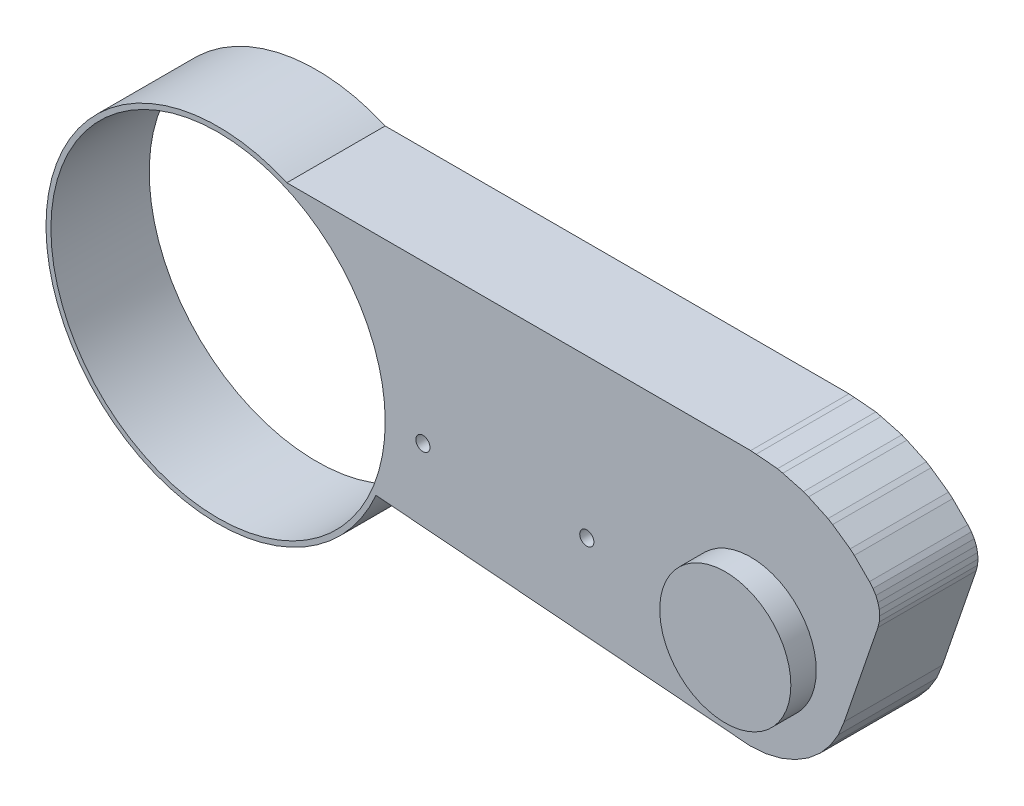
from build123d import *

# Parameters (mm, degrees)
BOSS_EXTRUDE1_START     = -3
SKETCH1_R               = 42
BOSS_EXTRUDE1_DEPTH     = 24
BOSS_EXTRUDE2_START     = -3
BOSS_EXTRUDE2_DEPTH     = 24
CUT_EXTRUDE1_START      = -3
CUT_EXTRUDE1_DEPTH      = 22.8
CUT_EXTRUDE2_DEPTH      = 169.170182404
CUT_EXTRUDE2_DEPTH_BACK = 169.170182404
SKETCH4_R               = 40.8
BOSS_EXTRUDE3_START     = 21
SKETCH5_R               = 16
BOSS_EXTRUDE3_DEPTH     = 6.2
CUT_EXTRUDE3_START      = 19.8
SKETCH6_R               = 14.8
CUT_EXTRUDE3_DEPTH      = 6.2
BOSS_EXTRUDE4_START     = 9
SKETCH7_R               = 3.5
BOSS_EXTRUDE4_DEPTH     = 10.8
CUT_EXTRUDE4_DEPTH      = 170.05635229
CUT_EXTRUDE4_DEPTH_BACK = 170.05635229
SKETCH8_R               = 1.725


with BuildPart() as part:
    # Sketch1 → Boss-Extrude1 (new body)
    with BuildSketch(Plane.XY.offset(BOSS_EXTRUDE1_START)):
        Circle(SKETCH1_R)
    extrude(amount=BOSS_EXTRUDE1_DEPTH)

    # Sketch2 → Boss-Extrude2 (add)
    with BuildSketch(Plane.XY.offset(BOSS_EXTRUDE2_START)):
        Polygon((-38.5, 0), (-38.3954, -1.3297), (-38.084, -2.6266), (-37.5736, -3.8589), (-36.8766, -4.9962), (-36.0104, -6.0104), (-34.9962, -6.8766), (-33.8589, -7.5736), (-32.6266, -8.084), (-31.3297, -8.3954), (27.497, -15.803), (126.2456, -23.7045), (130, -24), (133.7544, -23.7045), (137.4164, -22.8254), (140.8958, -21.3842), (144.1068, -19.4164), (146.9706, -16.9706), (149.4164, -14.1068), (151.3842, -10.8958), (152.8254, -7.4164), (161.0653, 16.657), (161.3767, 17.9539), (161.4813, 19.2836), (161.3767, 20.6133), (161.0653, 21.9103), (160.5549, 23.1425), (159.858, 24.2798), (158.9917, 25.294), (155.294, 28.9917), (154.2798, 29.858), (149.9962, 32.8574), (148.8589, 33.5543), (144.1195, 35.7643), (142.8872, 36.2748), (137.8361, 37.6282), (136.5391, 37.9396), (131.3297, 38.3954), (130, 38.5), (0, 38.5), (-1.3297, 38.3954), (-6.5391, 37.9396), (-7.8361, 37.6282), (-12.8872, 36.2748), (-14.1195, 35.7643), (-18.8589, 33.5543), (-19.9962, 32.8574), (-24.2798, 29.858), (-25.294, 28.9917), (-28.9917, 25.294), (-29.858, 24.2798), (-32.8574, 19.9962), (-33.5543, 18.8589), (-35.7643, 14.1195), (-36.2748, 12.8872), (-37.6282, 7.8361), (-37.9396, 6.5391), (-38.3954, 1.3297), align=None)
    extrude(amount=BOSS_EXTRUDE2_DEPTH)

    # Sketch3 → Cut-Extrude1 (cut)
    with BuildSketch(Plane.XY.offset(CUT_EXTRUDE1_START)):
        Polygon((-37.3, 0), (-37.2101, -1.142), (-36.9427, -2.2558), (-36.5043, -3.3141), (-35.9058, -4.2908), (-35.1619, -5.1619), (-34.2908, -5.9058), (-33.3141, -6.5043), (-32.2558, -6.9427), (-31.142, -7.2101), (27.6848, -14.6178), (126.4333, -22.5193), (130, -22.8), (133.5667, -22.5193), (137.0456, -21.6841), (140.351, -20.3149), (143.4015, -18.4456), (146.122, -16.122), (148.4456, -13.4015), (150.3149, -10.351), (151.6841, -7.0456), (159.924, 17.0278), (160.1915, 18.1417), (160.2813, 19.2836), (160.1915, 20.4256), (159.924, 21.5395), (159.4857, 22.5978), (158.8872, 23.5745), (158.1432, 24.4455), (154.4455, 28.1432), (153.5745, 28.8872), (149.2908, 31.8866), (148.3141, 32.4851), (143.5747, 34.6951), (142.5164, 35.1335), (137.4653, 36.4869), (136.3514, 36.7544), (131.142, 37.2101), (130, 37.3), (0, 37.3), (-1.142, 37.2101), (-6.3514, 36.7544), (-7.4653, 36.4869), (-12.5164, 35.1335), (-13.5747, 34.6951), (-18.3141, 32.4851), (-19.2908, 31.8866), (-23.5745, 28.8872), (-24.4455, 28.1432), (-28.1432, 24.4455), (-28.8872, 23.5745), (-31.8866, 19.2908), (-32.4851, 18.3141), (-34.6951, 13.5747), (-35.1335, 12.5164), (-36.4869, 7.4653), (-36.7544, 6.3514), (-37.2101, 1.142), align=None)
    extrude(amount=CUT_EXTRUDE1_DEPTH, mode=Mode.SUBTRACT)

    # Sketch4 → Cut-Extrude2 (cut, two sides: drawn at the far end of the back side and taken through both)
    with BuildSketch(Plane.XY.offset(-CUT_EXTRUDE2_DEPTH_BACK)):
        Circle(SKETCH4_R)
    extrude(amount=CUT_EXTRUDE2_DEPTH + CUT_EXTRUDE2_DEPTH_BACK, mode=Mode.SUBTRACT)

    # Sketch5 → Boss-Extrude3 (add)
    with BuildSketch(Plane.XY.offset(BOSS_EXTRUDE3_START)):
        with Locations((130, 0)):
            Circle(SKETCH5_R)
    extrude(amount=BOSS_EXTRUDE3_DEPTH)

    # Sketch6 → Cut-Extrude3 (cut)
    with BuildSketch(Plane.XY.offset(CUT_EXTRUDE3_START)):
        with Locations((130, 0)):
            Circle(SKETCH6_R)
    extrude(amount=CUT_EXTRUDE3_DEPTH, mode=Mode.SUBTRACT)

    # Sketch7 → Boss-Extrude4 (add)
    with BuildSketch(Plane.XY.offset(BOSS_EXTRUDE4_START)):
        with Locations(Location((50, 0, 0), (0, 0, 180))):
            Circle(SKETCH7_R)
        with Locations(Location((90, 0, 0), (0, 0, 180))):
            Circle(SKETCH7_R)
    extrude(amount=BOSS_EXTRUDE4_DEPTH)

    # Sketch8 → Cut-Extrude4 (cut, two sides: drawn at the far end of the back side and taken through both)
    with BuildSketch(Plane.XY.offset(-CUT_EXTRUDE4_DEPTH_BACK)):
        with Locations((50, 0)):
            Circle(SKETCH8_R)
        with Locations((90, 0)):
            Circle(SKETCH8_R)
    extrude(amount=CUT_EXTRUDE4_DEPTH + CUT_EXTRUDE4_DEPTH_BACK, mode=Mode.SUBTRACT)


solid = part.part
